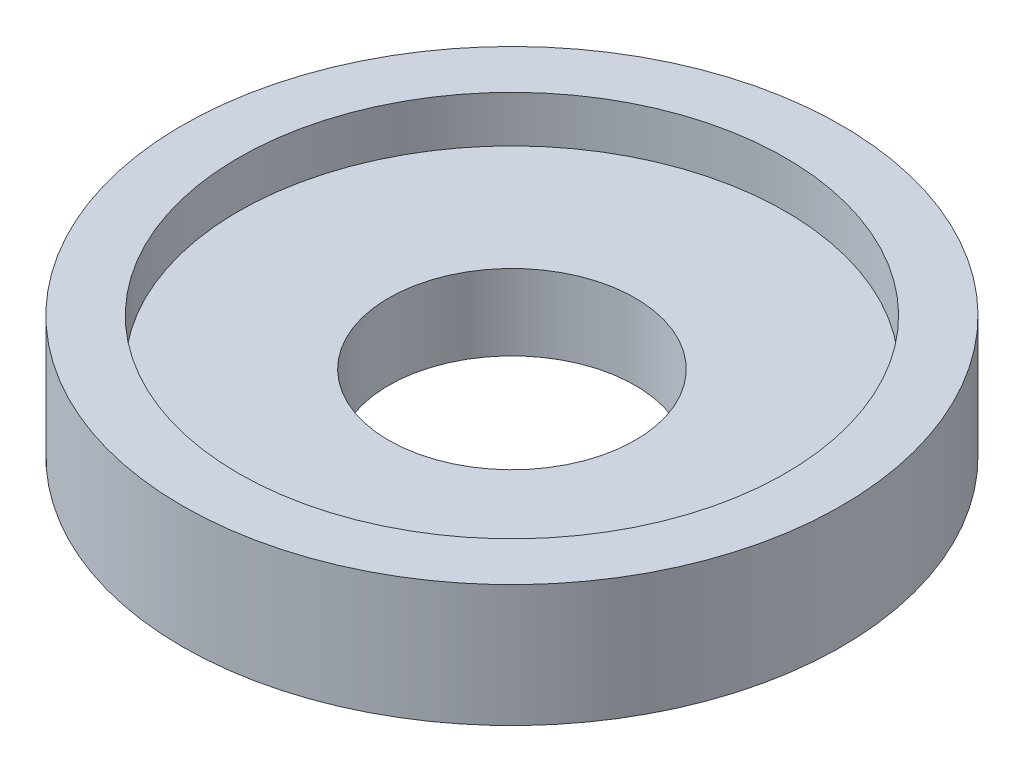
from build123d import *

# Parameters (mm, degrees)
SKETCH1_R           = 13.5
SKETCH1_R_2         = 5.05
BOSS_EXTRUDE1_DEPTH = 5
SKETCH2_R           = 11.2
CUT_EXTRUDE1_DEPTH  = 1.9


with BuildPart() as part:
    # Sketch1 → Boss-Extrude1 (new body)
    with BuildSketch(Plane(origin=(0, 0, 0), x_dir=(1, 0, 0), z_dir=(0, 1, 0))):
        with Locations(Location((0, 0, 0), (0, 0, 270))):
            Circle(SKETCH1_R)
        with Locations(Location((0, 0, 0), (0, 0, 270))):
            Circle(SKETCH1_R_2, mode=Mode.SUBTRACT)
    extrude(amount=BOSS_EXTRUDE1_DEPTH)

    # Sketch2 → Cut-Extrude1 (cut)
    with BuildSketch(Plane(origin=(0, 5, 0), x_dir=(1, 0, 0), z_dir=(0, 1, 0))):
        with Locations(Location((0, 0, 0), (0, 0, 270))):
            Circle(SKETCH2_R)
    extrude(amount=-CUT_EXTRUDE1_DEPTH, mode=Mode.SUBTRACT)


solid = part.part
